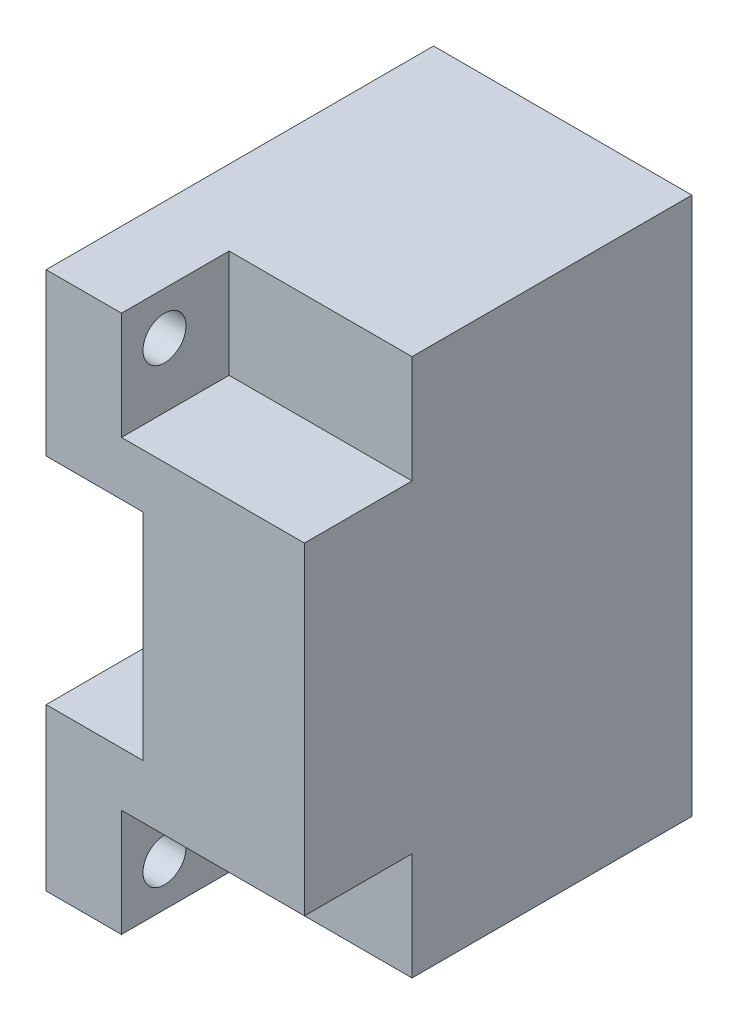
from build123d import *
from build123d.topology import SkipClean

# Parameters (mm, degrees)
SKETCH_1_W               = 25
SKETCH_1_H               = 25
EXTRUDE_1_DEPTH          = 10
SKETCH_2_R               = 10
CUT_EXTRUDE_1_DEPTH      = 7
SKETCH_3_R               = 4.5
CUT_EXTRUDE_2_DEPTH      = 20.013153342
SKETCH_4_R               = 2
CUT_EXTRUDE_4_DEPTH      = 20.013153342
PATTERN_CIRCULAR_1_COUNT = 4
SKETCH_5_W               = 25
SKETCH_5_H               = 25
EXTRUDE_2_DEPTH          = 8
SKETCH_6_W               = 10
SKETCH_6_H               = 10
CUT_EXTRUDE_5_DEPTH      = 8
SKETCH_8_W               = 17.447834749
SKETCH_8_H               = 20.945056097
CUT_EXTRUDE_8_DEPTH      = 34.24530042
CUT_EXTRUDE_START        = -4
SKETCH_12_W              = 5
SKETCH_12_H              = 5
CUT_EXTRUDE_9_DEPTH      = 22.228951623
SKETCH_13_R              = 1
CUT_EXTRUDE_10_DEPTH     = 24.505318547
SKETCH_14_W              = 16.881791219
SKETCH_14_H              = 21.447400351
CUT_EXTRUDE_11_DEPTH     = 34.24530042


with BuildPart() as part:
    # 草图1 → 凸台-拉伸1 (new body)
    with BuildSketch(Plane.XY):
        Rectangle(SKETCH_1_W, SKETCH_1_H)
    extrude(amount=EXTRUDE_1_DEPTH)

    # 草图2 → 切除-拉伸1 (cut)
    with BuildSketch(Plane.XY.offset(10)):
        Circle(SKETCH_2_R)
    extrude(amount=-CUT_EXTRUDE_1_DEPTH, mode=Mode.SUBTRACT)

    # 草图3 → 切除-拉伸2 (cut, through all)
    with BuildSketch(Plane.XY.offset(3)):
        Circle(SKETCH_3_R)
    extrude(amount=-CUT_EXTRUDE_2_DEPTH, mode=Mode.SUBTRACT)

    # 草图4 → 切除-拉伸4 (cut, through all)
    with BuildSketch(Plane.XY.offset(3)):
        with Locations((-4.949747468, 4.949747468)):
            Circle(SKETCH_4_R)
    cut_extrude_4 = extrude(amount=-CUT_EXTRUDE_4_DEPTH, mode=Mode.SUBTRACT)

    # 阵列(圆周)1: 切除-拉伸4 ×4 about axis
    pattern_circular_1_axis = Axis((0, 0, 0), (0, 0, 1))
    for i in range(1, PATTERN_CIRCULAR_1_COUNT):
        add(cut_extrude_4.rotate(pattern_circular_1_axis, i * 360 / PATTERN_CIRCULAR_1_COUNT), mode=Mode.SUBTRACT)

    # 草图5 → 凸台-拉伸2 (add)
    with BuildSketch(Plane.XY.offset(10)):
        Rectangle(SKETCH_5_W, SKETCH_5_H)
    extrude(amount=EXTRUDE_2_DEPTH)

    # 草图6 → 切除-拉伸5 (cut)
    with BuildSketch(Plane.XY.offset(18)):
        Rectangle(SKETCH_6_W, SKETCH_6_H)
    extrude(amount=-CUT_EXTRUDE_5_DEPTH, mode=Mode.SUBTRACT)

    # 草图8 → 切除-拉伸8 (cut, through all)
    with BuildSketch(Plane.XZ.offset(12.5)):
        with Locations((8.723917375, 10.472528049)):
            Rectangle(SKETCH_8_W, SKETCH_8_H)
    extrude(amount=-CUT_EXTRUDE_8_DEPTH, mode=Mode.SUBTRACT)

    # 草图12 → 切除-拉伸9 (cut, through all)
    with BuildSketch(Plane(origin=(0, 0, 0), x_dir=(0, 0, -1), z_dir=(1, 0, 0)).offset(CUT_EXTRUDE_START)):
        with Locations((-15.5, -10)):
            Rectangle(SKETCH_12_W, SKETCH_12_H)
    cut_extrude_9 = extrude(amount=-CUT_EXTRUDE_9_DEPTH, mode=Mode.SUBTRACT)

    # 镜向1: 切除-拉伸9 across plane
    add(cut_extrude_9.mirror(Plane.ZX), mode=Mode.SUBTRACT)

    # 草图13 → 切除-拉伸10 (cut, through all)
    with BuildSketch(Plane.ZY.offset(4)):
        with Locations((16, -10.5)):
            Circle(SKETCH_13_R)
    cut_extrude_10 = extrude(amount=-CUT_EXTRUDE_10_DEPTH, mode=Mode.SUBTRACT)

    # 镜向2: 切除-拉伸10 across plane
    add(cut_extrude_10.mirror(Plane.ZX), mode=Mode.SUBTRACT)

    # 镜向3: part across plane


with BuildPart() as part_1:
    with SkipClean():  # the faces are left unmerged after this step: merging them gives an invalid solid
        add(part.part)
        add(part.part.mirror(Plane(origin=(0, 12.5, 0), x_dir=(0, 0, 1), z_dir=(-1, 0, 0))))

    # 草图14 → 切除-拉伸11 (cut, through all)
    with BuildSketch(Plane.XZ.offset(12.5)):
        with Locations((-7.94089561, 10.723700176)):
            Rectangle(SKETCH_14_W, SKETCH_14_H)
    extrude(amount=-CUT_EXTRUDE_11_DEPTH, mode=Mode.SUBTRACT)


solid = part_1.part
